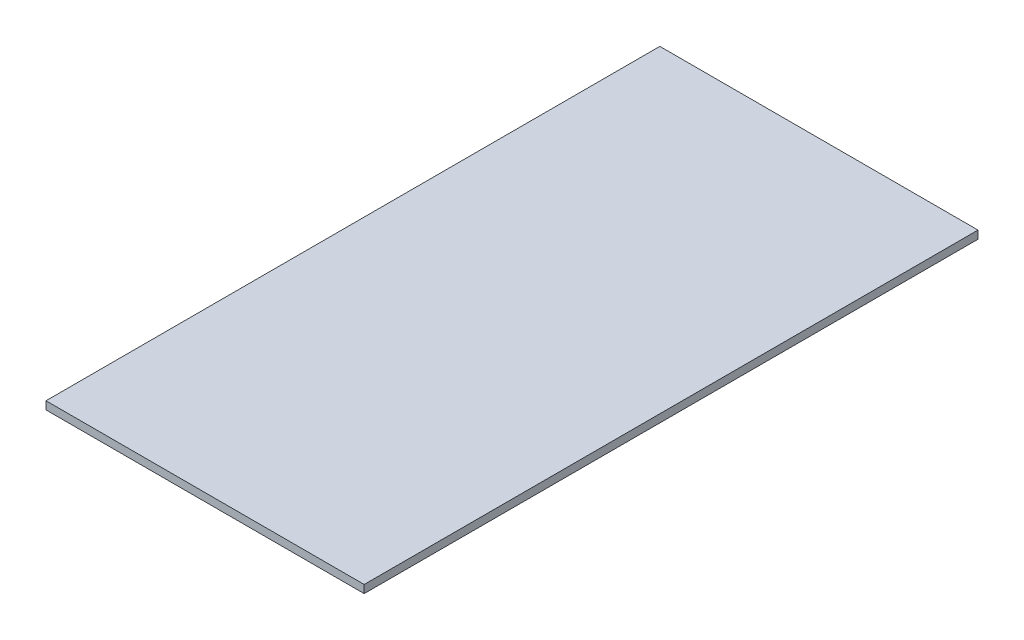
from build123d import *

# Parameters (mm, degrees)
SKETCH1_W           = 120
SKETCH1_H           = 231.5
BOSS_EXTRUDE1_DEPTH = 3


with BuildPart() as part:
    # Sketch1 → Boss-Extrude1 (new body)
    with BuildSketch(Plane(origin=(0, 0, 0), x_dir=(1, 0, 0), z_dir=(0, 1, 0))):
        Rectangle(SKETCH1_W, SKETCH1_H)
    extrude(amount=BOSS_EXTRUDE1_DEPTH)


solid = part.part
